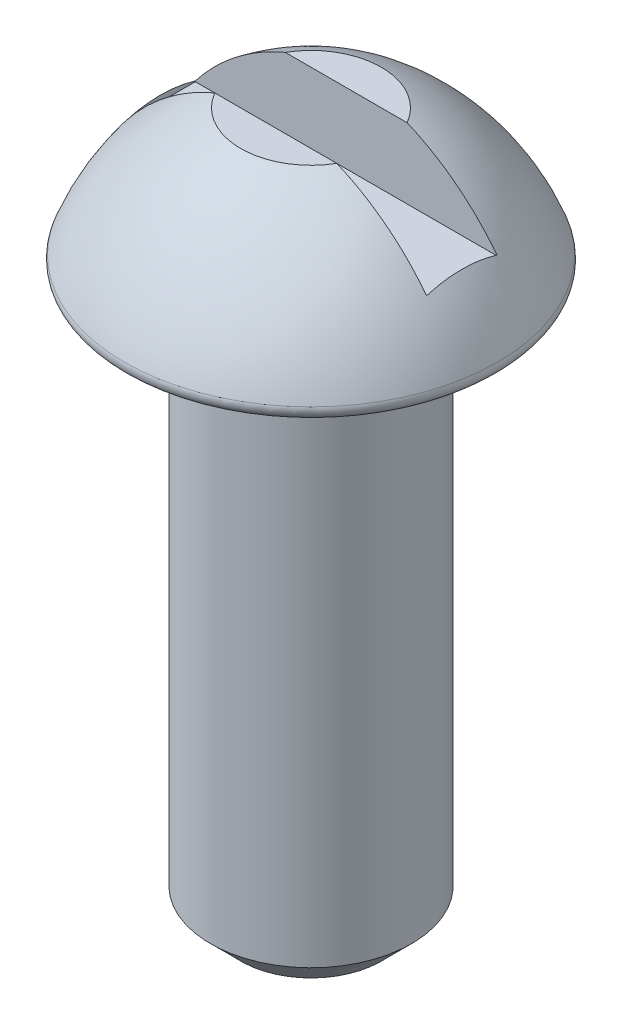
from build123d import *

# Parameters (mm, degrees)
FILLET_1_R          = 0.1
SKETCH_2_W          = 3
SKETCH_2_H          = 0.7
CUT_EXTRUDE_1_DEPTH = 0.7


with BuildPart() as part:
    # Эскиз1 → Повернуть1 (revolve)
    with BuildSketch(Plane.XY):
        with BuildLine():
            Line((1.9, 5.6), (1, 5.6))
            Line((1, 5.6), (1, 0.3))
            Line((1, 0.3), (0.7, 0))
            Line((0.7, 0), (0, 0))
            Line((0, 0), (0, 7))
            Line((0, 7), (0.7, 7))
            ThreePointArc((0.7, 7), (1.445839439, 6.425005233), (1.9, 5.6))
        make_face()
    revolve(axis=Axis((0, 0, 0), (0, 1, 0)))

    # Скругление1
    fillet_1_edges = [part.edges().sort_by_distance(p)[0] for p in [
        (-1.9, 5.6, 0),
    ]]
    fillet(fillet_1_edges, radius=FILLET_1_R)

    # Эскиз2 → Вырез-Вытянуть1 (cut)
    with BuildSketch(Plane(origin=(0, 7, 0), x_dir=(-1, 0, 0), z_dir=(0, 1, 0))):
        Rectangle(SKETCH_2_W, SKETCH_2_H)
    extrude(amount=-CUT_EXTRUDE_1_DEPTH, mode=Mode.SUBTRACT)


solid = part.part
